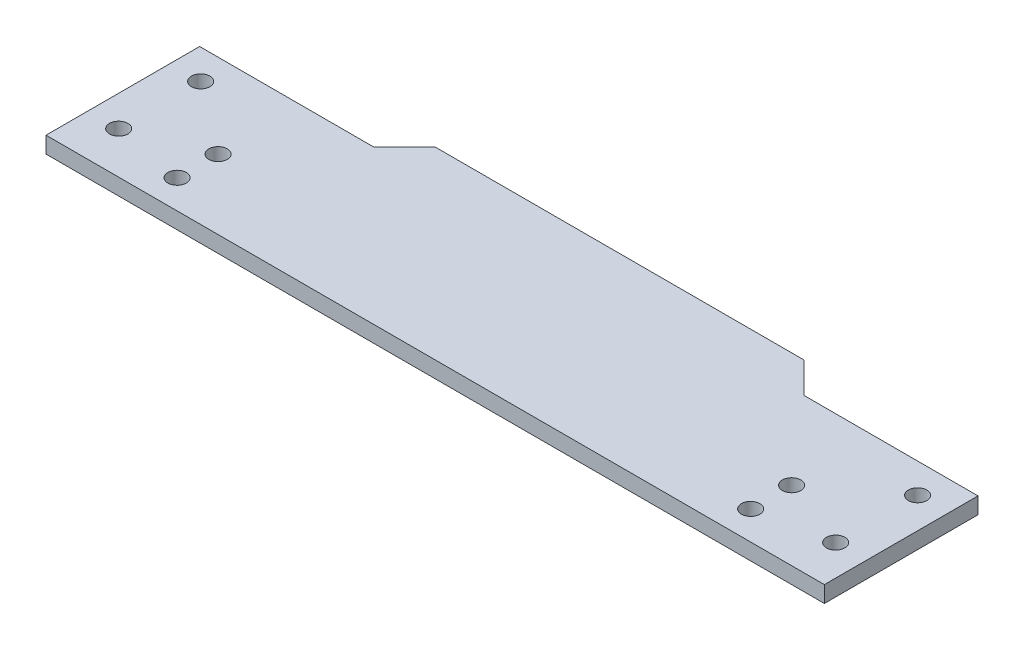
from build123d import *

# Parameters (mm, degrees)
ESQUISSE1_R        = 4.5
BOSS_EXTRU_1_DEPTH = 8


with BuildPart() as part:
    # Esquisse1 → Boss.-Extru.1 (new body)
    # profile 1 of 2: a face of its own
    with BuildSketch(Plane(origin=(0, 0, 0), x_dir=(1, 0, 0), z_dir=(0, 1, 0))):
        Polygon((-190, 75), (-190, 0), (0, 0), (0, 90), (-90, 90), (-105, 75), align=None)
        with Locations(Location((-175, 20.5, 0), (0, 0, 270))):
            Circle(ESQUISSE1_R, mode=Mode.SUBTRACT)
        with Locations(Location((-140, 14, 0), (0, 0, 270))):
            Circle(ESQUISSE1_R, mode=Mode.SUBTRACT)
        with Locations(Location((-140, 34, 0), (0, 0, 270))):
            Circle(ESQUISSE1_R, mode=Mode.SUBTRACT)
        with Locations(Location((-175, 60.5, 0), (0, 0, 270))):
            Circle(ESQUISSE1_R, mode=Mode.SUBTRACT)
    # profile 2 of 2: a face of its own
    with BuildSketch(Plane(origin=(0, 0, 0), x_dir=(1, 0, 0), z_dir=(0, 1, 0))):
        Polygon((0, 90), (0, 0), (190, 0), (190, 75), (105, 75), (90, 90), align=None)
        with Locations(Location((140, 14, 0), (0, 0, 270))):
            Circle(ESQUISSE1_R, mode=Mode.SUBTRACT)
        with Locations(Location((175, 20.5, 0), (0, 0, 270))):
            Circle(ESQUISSE1_R, mode=Mode.SUBTRACT)
        with Locations(Location((140, 34, 0), (0, 0, 270))):
            Circle(ESQUISSE1_R, mode=Mode.SUBTRACT)
        with Locations(Location((175, 60.5, 0), (0, 0, 270))):
            Circle(ESQUISSE1_R, mode=Mode.SUBTRACT)
    extrude(amount=BOSS_EXTRU_1_DEPTH)


solid = part.part
